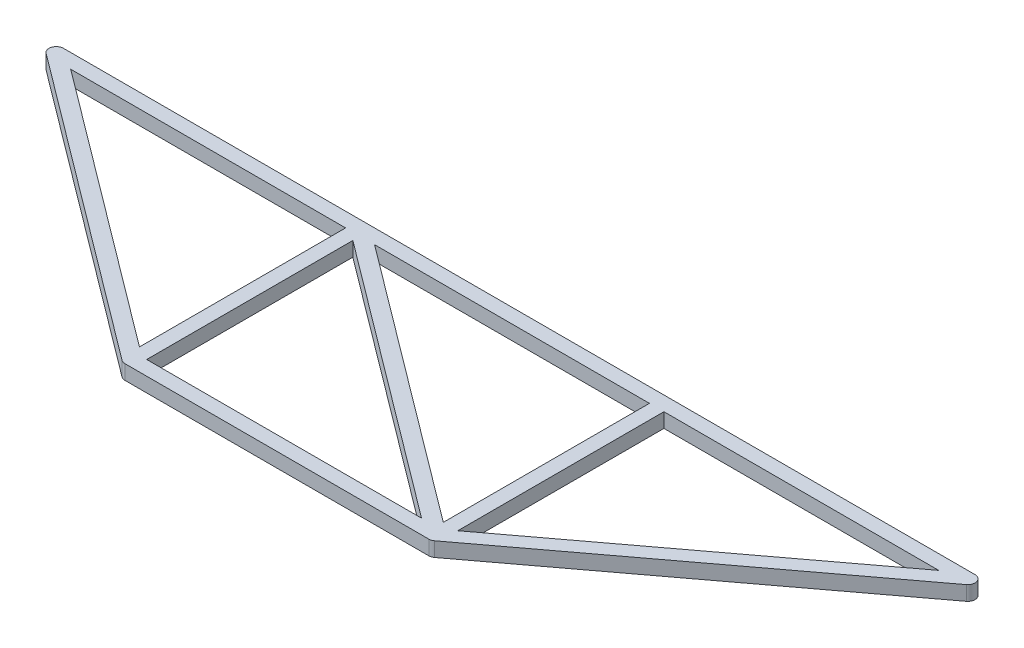
from build123d import *

# Parameters (mm, degrees)
BOSS_EXTRUDE1_DEPTH = 19.08


with BuildPart() as part:
    # Sketch15 → Boss-Extrude1 (new body)
    with BuildSketch(Plane(origin=(0, 0, 0), x_dir=(1, 0, 0), z_dir=(0, 1, 0))):
        with BuildLine():
            Line((0, 9.54), (1200, 9.54))
            ThreePointArc((1200, 9.54), (1209.050438663, 3.016812888), (1205.724, -7.632))
            Line((1205.724, -7.632), (805.724, -307.632))
            ThreePointArc((805.724, -307.632), (803.016812888, -309.050438663), (800, -309.54))
            Line((800, -309.54), (400, -309.54))
            ThreePointArc((400, -309.54), (396.983187112, -309.050438663), (394.276, -307.632))
            Line((394.276, -307.632), (-5.724, -7.632))
            ThreePointArc((-5.724, -7.632), (-9.050438663, 3.016812888), (0, 9.54))
        make_face()
        Polygon((390.46, -280.92), (390.46, -9.54), (28.62, -9.54), align=None, mode=Mode.SUBTRACT)
        Polygon((409.54, -19.08), (409.54, -290.46), (771.38, -290.46), align=None, mode=Mode.SUBTRACT)
        Polygon((790.46, -280.921851045), (428.61753194, -9.54), (790.46, -9.54), align=None, mode=Mode.SUBTRACT)
        Polygon((809.54, -280.92), (1171.38, -9.54), (809.54, -9.54), align=None, mode=Mode.SUBTRACT)
    extrude(amount=BOSS_EXTRUDE1_DEPTH)


solid = part.part
